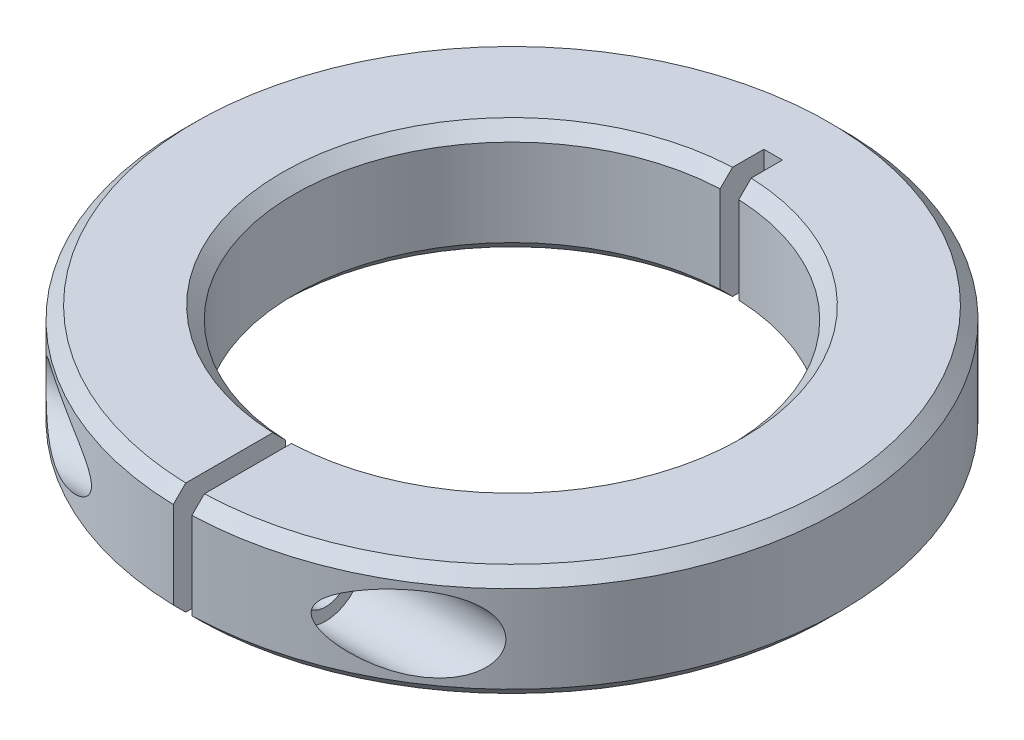
from build123d import *

# Parameters (mm, degrees)
BOSS_EXTRUDE1_DEPTH = 9
CHAMFER1_SIZE       = 1
SKETCH2_R           = 2
CUT_EXTRUDE1_DEPTH  = 25
CUT_EXTRUDE2_START  = -7
SKETCH2_3_R         = 3
SKETCH2_3_R_2       = 2
CUT_EXTRUDE2_DEPTH  = 15
CUT_EXTRUDE3_START  = 24
SKETCH2_4_R         = 3
SKETCH2_4_R_2       = 2
CUT_EXTRUDE3_DEPTH  = 17


with BuildPart() as part:
    # Sketch1 → Boss-Extrude1 (new body)
    with BuildSketch(Plane(origin=(0, 0, 0), x_dir=(1, 0, 0), z_dir=(0, 1, 0))):
        with BuildLine():
            Line((-0.75, 21), (-0.75, 17.483921185))
            ThreePointArc((-0.75, 17.483921185), (-17.5, 0), (-0.75, -17.483921185))
            Line((-0.75, -17.483921185), (-0.75, -26.489384666))
            ThreePointArc((-0.75, -26.489384666), (0, 26.5), (0.75, -26.489384666))
            Line((0.75, -26.489384666), (0.75, -17.483921185))
            ThreePointArc((0.75, -17.483921185), (17.5, 0), (0.75, 17.483921185))
            Line((0.75, 17.483921185), (0.75, 21))
            Line((0.75, 21), (-0.75, 21))
        make_face()
    extrude(amount=BOSS_EXTRUDE1_DEPTH)

    # Chamfer1
    chamfer1_edges = [part.edges().sort_by_distance(p)[0] for p in [
        (17.5, 0, 0),
        (-17.5, 0, 0),
        (0, 0, -26.5),
        (17.5, 9, 0),
        (-17.5, 9, 0),
        (0, 9, -26.5),
    ]]
    chamfer(chamfer1_edges, length=CHAMFER1_SIZE)

    # Sketch2 → Cut-Extrude1 (cut, symmetric)
    with BuildSketch(Plane(origin=(0, 0, 0), x_dir=(0, 0, -1), z_dir=(1, 0, 0))):
        with Locations((-21.983921185, 4.5)):
            Circle(SKETCH2_R)
    extrude(amount=CUT_EXTRUDE1_DEPTH, both=True, mode=Mode.SUBTRACT)

    # Sketch2<3> → Cut-Extrude2 (cut)
    with BuildSketch(Plane(origin=(0, 0, 0), x_dir=(0, 0, -1), z_dir=(1, 0, 0)).offset(CUT_EXTRUDE2_START)):
        with Locations((-21.983921185, 4.5)):
            Circle(SKETCH2_3_R)
        with Locations((-21.983921185, 4.5)):
            Circle(SKETCH2_3_R_2, mode=Mode.SUBTRACT)
    extrude(amount=-CUT_EXTRUDE2_DEPTH, mode=Mode.SUBTRACT)

    # Sketch2<4> → Cut-Extrude3 (cut)
    with BuildSketch(Plane(origin=(0, 0, 0), x_dir=(0, 0, -1), z_dir=(1, 0, 0)).offset(CUT_EXTRUDE3_START)):
        with Locations((-21.983921185, 4.5)):
            Circle(SKETCH2_4_R)
        with Locations((-21.983921185, 4.5)):
            Circle(SKETCH2_4_R_2, mode=Mode.SUBTRACT)
    extrude(amount=-CUT_EXTRUDE3_DEPTH, mode=Mode.SUBTRACT)


solid = part.part
